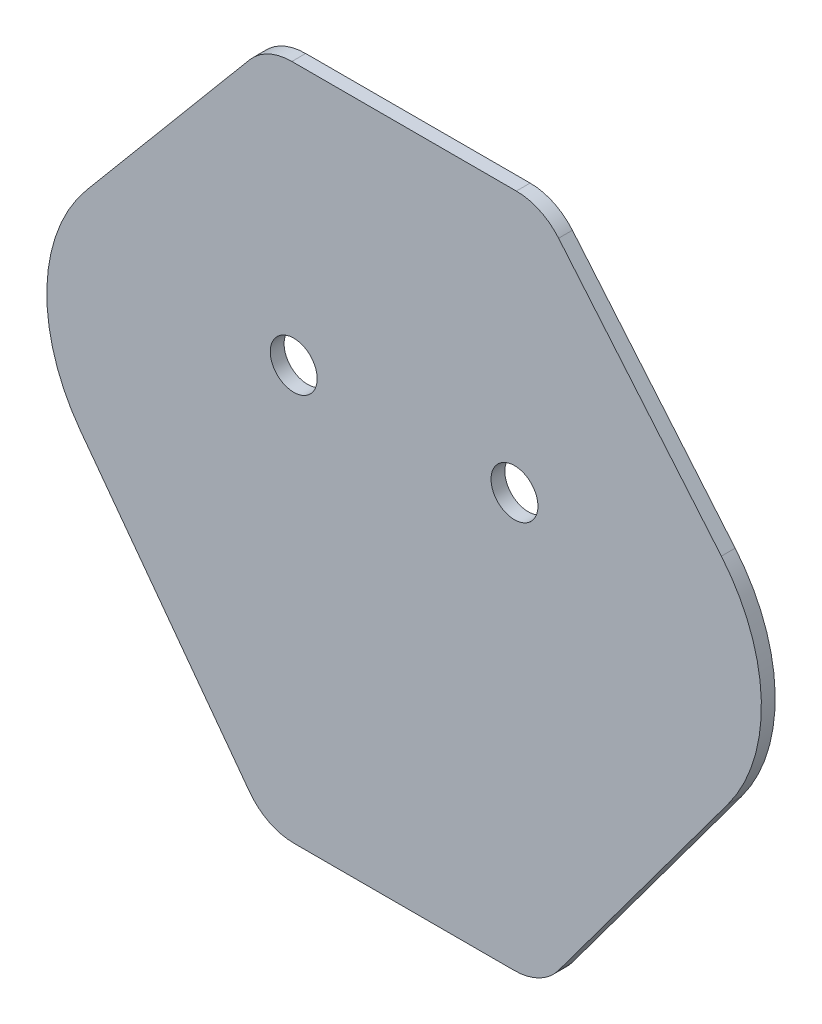
from build123d import *

# Parameters (mm, degrees)
SKETCH1_R           = 10.795
BOSS_EXTRUDE1_DEPTH = 3.175
FILLET1_R           = 25.4
FILLET2_R           = 78.74


with BuildPart() as part:
    # Sketch1 → Boss-Extrude1 (new, symmetric)
    with BuildSketch(Plane.XY):
        Polygon((-63.5, 155.575), (-185.951039645, 9.643533586), (-63.5, -155.575), (63.5, -155.575), (185.951039645, 9.643533586), (63.5, 155.575), align=None)
        with Locations((-50.8, 34.925)):
            Circle(SKETCH1_R, mode=Mode.SUBTRACT)
        with Locations((50.8, 34.925)):
            Circle(SKETCH1_R, mode=Mode.SUBTRACT)
    extrude(amount=BOSS_EXTRUDE1_DEPTH, both=True)

    # Fillet1
    fillet1_edges = [part.edges().sort_by_distance(p)[0] for p in [
        (63.5, 155.575, 0),
        (63.5, -155.575, 0),
        (-63.5, -155.575, 0),
        (-63.5, 155.575, 0),
    ]]
    fillet(fillet1_edges, radius=FILLET1_R)

    # Fillet2
    fillet2_edges = [part.edges().sort_by_distance(p)[0] for p in [
        (185.951039645, 9.643533586, 0),
        (-185.951039645, 9.643533586, 0),
    ]]
    fillet(fillet2_edges, radius=FILLET2_R)


solid = part.part
